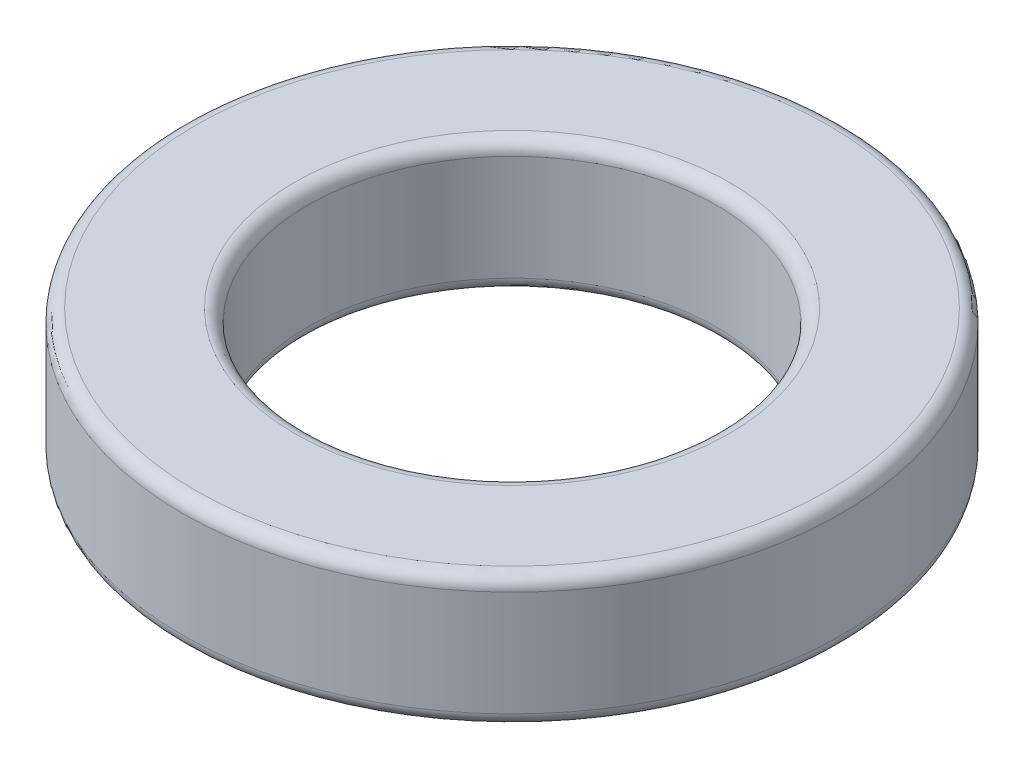
from build123d import *

# Parameters (mm, degrees)
SKETCH1_R           = 2.5
SKETCH1_R_2         = 1.55
BOSS_EXTRUDE1_DEPTH = 1
FILLET1_R           = 0.1


with BuildPart() as part:
    # Sketch1 → Boss-Extrude1 (new body)
    with BuildSketch(Plane(origin=(0, 0, 0), x_dir=(1, 0, 0), z_dir=(0, 1, 0))):
        with Locations(Location((0, 0, 0), (0, 0, 270))):
            Circle(SKETCH1_R)
        with Locations(Location((0, 0, 0), (0, 0, 270))):
            Circle(SKETCH1_R_2, mode=Mode.SUBTRACT)
    extrude(amount=BOSS_EXTRUDE1_DEPTH)

    # Fillet1
    fillet1_edges = [part.edges().sort_by_distance(p)[0] for p in [
        (0, 0, -2.5),
        (0, 1, -2.5),
        (0, 0, -1.55),
        (0, 1, -1.55),
    ]]
    fillet(fillet1_edges, radius=FILLET1_R)


solid = part.part
